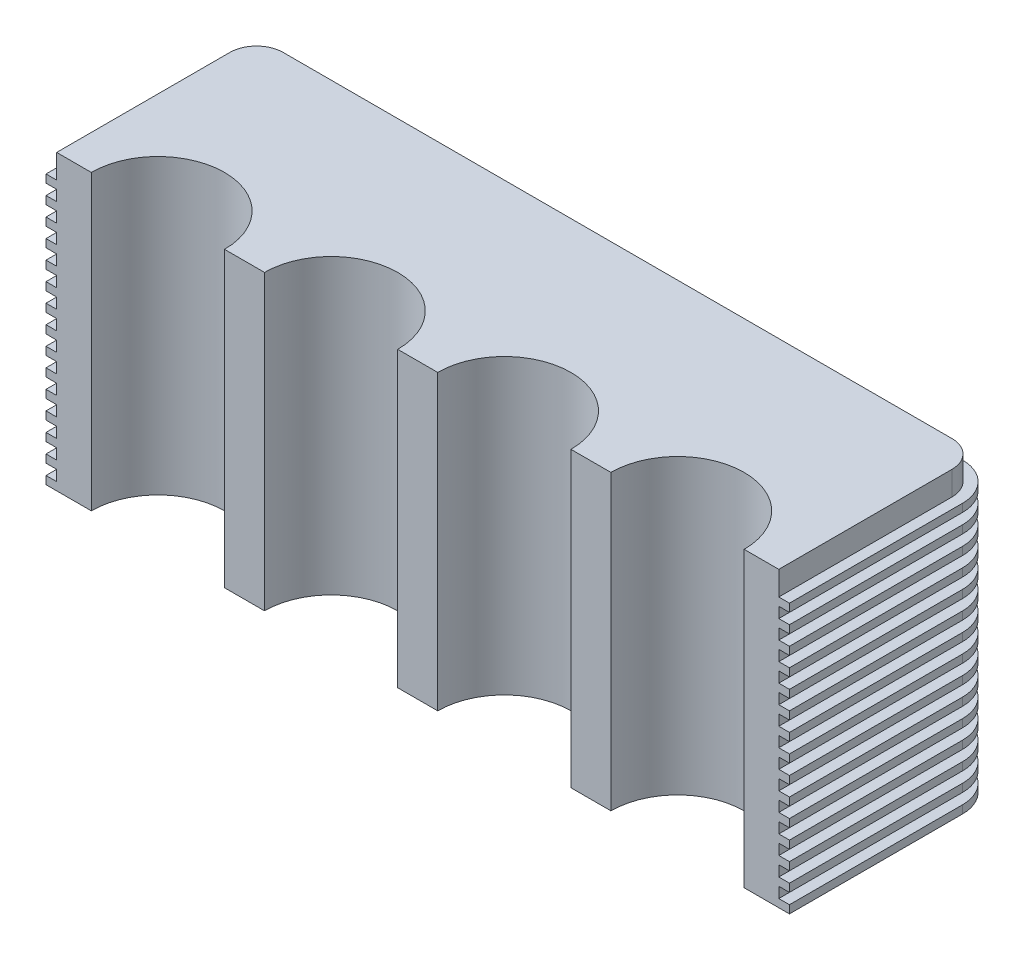
from build123d import *

# Parameters (mm, degrees)
BOSS_EXTRUDE1_DEPTH = 110
BOSS_EXTRUDE2_DEPTH = 3
LPATTERN1_COUNT     = 15
LPATTERN1_PITCH     = 7


with BuildPart() as part:
    # Sketch1 → Boss-Extrude1 (new body)
    with BuildSketch(Plane(origin=(0, 0, 0), x_dir=(1, 0, 0), z_dir=(0, 1, 0))):
        with BuildLine():
            Line((0, 0), (13, 0))
            ThreePointArc((13, 0), (38, 25), (63, 0))
            Line((63, 0), (78, 0))
            ThreePointArc((78, 0), (103, 25), (128, 0))
            Line((128, 0), (143, 0))
            ThreePointArc((143, 0), (168, 25), (193, 0))
            Line((193, 0), (208, 0))
            ThreePointArc((208, 0), (233, 25), (258, 0))
            Line((258, 0), (271, 0))
            Line((271, 0), (271, 65))
            ThreePointArc((271, 65), (268.071067812, 72.071067812), (261, 75))
            Line((261, 75), (10, 75))
            ThreePointArc((10, 75), (2.928932188, 72.071067812), (0, 65))
            Line((0, 65), (0, 0))
        make_face()
    extrude(amount=BOSS_EXTRUDE1_DEPTH)

    # Sketch2 → Boss-Extrude2 (add)
    with BuildSketch(Plane(origin=(0, 0, 0), x_dir=(1, 0, 0), z_dir=(0, 1, 0))):
        with BuildLine():
            Line((275, 0), (275, 65))
            ThreePointArc((275, 65), (270.899494937, 74.899494937), (261, 79))
            Line((261, 79), (10, 79))
            ThreePointArc((10, 79), (0.100505063, 74.899494937), (-4, 65))
            Line((-4, 65), (-4, 0))
            Line((-4, 0), (0, 0))
            Line((0, 0), (0, 65))
            ThreePointArc((0, 65), (2.928932188, 72.071067812), (10, 75))
            Line((10, 75), (261, 75))
            ThreePointArc((261, 75), (268.071067812, 72.071067812), (271, 65))
            Line((271, 65), (271, 0))
            Line((271, 0), (275, 0))
        make_face()
    boss_extrude2 = extrude(amount=BOSS_EXTRUDE2_DEPTH)

    # LPattern1: Boss-Extrude2 ×15
    with Locations(*[(0, i * LPATTERN1_PITCH, 0) for i in range(1, LPATTERN1_COUNT)]):
        add(boss_extrude2)


solid = part.part
